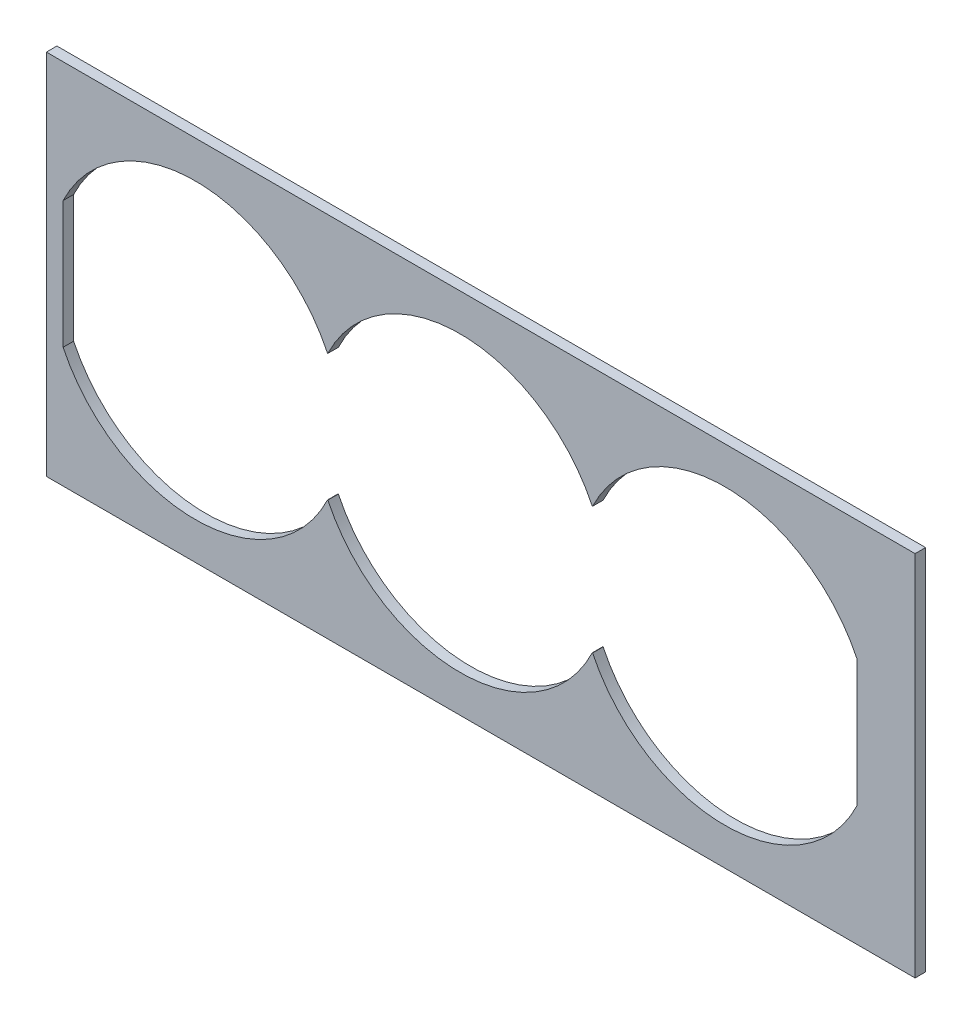
from build123d import *

# Parameters (mm, degrees)
SKETCH4_W           = 330.2
SKETCH4_H           = 139.7
BOSS_EXTRUDE3_DEPTH = 4


with BuildPart() as part:
    # Sketch4 → Boss-Extrude3 (new body)
    with BuildSketch(Plane.XY):
        with Locations((165.1, 69.85)):
            Rectangle(SKETCH4_W, SKETCH4_H)
        with BuildLine():
            Line((6.35, 93.996304065), (6.35, 45.703695935))
            ThreePointArc((6.35, 45.703695935), (56.604, 14.096), (106.858, 45.703695935))
            Line((106.858, 45.703695935), (106.985, 45.703695935))
            ThreePointArc((106.985, 45.703695935), (157.239, 14.096), (207.493, 45.703695935))
            Line((207.493, 45.703695935), (207.62, 45.703695935))
            ThreePointArc((207.62, 45.703695935), (257.874, 14.096), (308.128, 45.703695935))
            Line((308.128, 45.703695935), (308.128, 93.996304065))
            ThreePointArc((308.128, 93.996304065), (257.874, 125.604), (207.62, 93.996304065))
            Line((207.62, 93.996304065), (207.493, 93.996304065))
            ThreePointArc((207.493, 93.996304065), (157.239, 125.604), (106.985, 93.996304065))
            Line((106.985, 93.996304065), (106.858, 93.996304065))
            ThreePointArc((106.858, 93.996304065), (56.604, 125.604), (6.35, 93.996304065))
        make_face(mode=Mode.SUBTRACT)
    extrude(amount=BOSS_EXTRUDE3_DEPTH)


solid = part.part
